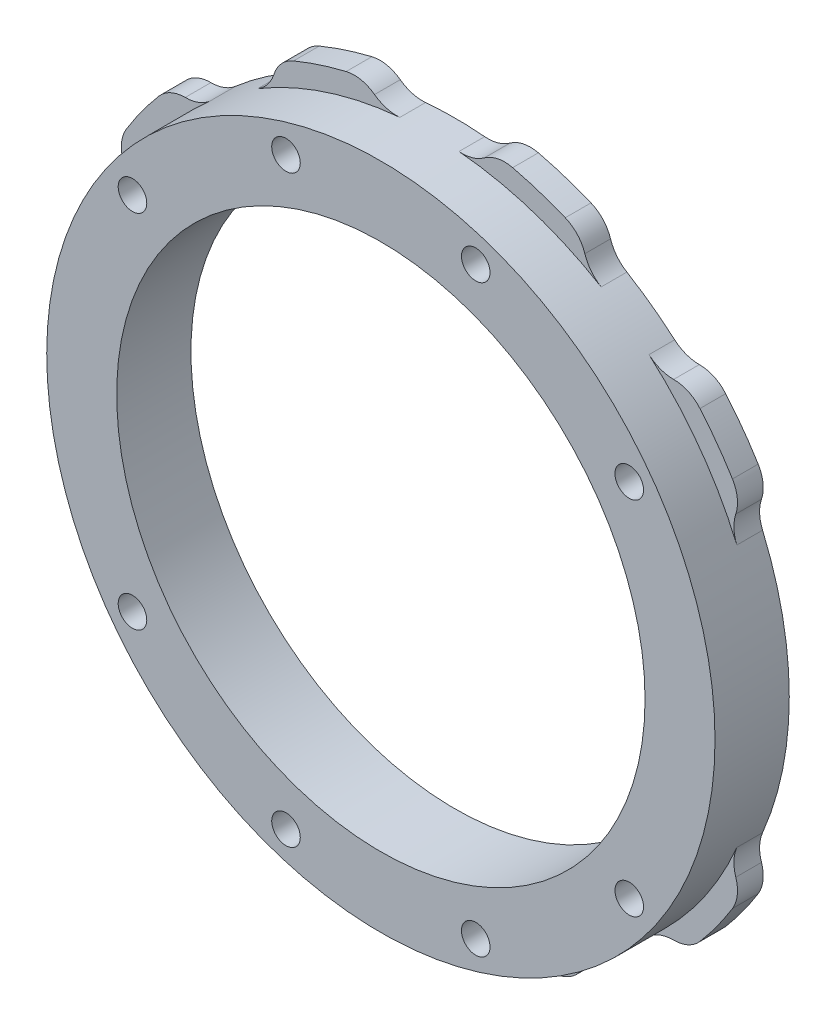
from build123d import *

# Parameters (mm, degrees)
SKIZZE1_R                       = 18.5
LINEAR_AUSTRAGEN1_DEPTH         = 1.8
SKIZZE2_R                       = 23.4
SKIZZE2_R_2                     = 18.5
LINEAR_AUSTRAGEN2_DEPTH         = 3.4
SKIZZE3_R                       = 1
SCHNITT_LINEAR_AUSTRAGEN1_DEPTH = 35.115425177
CHAMFER1_SIZE                   = 1.4


with BuildPart() as part:
    # Skizze1 → Linear austragen1 (new body)
    with BuildSketch(Plane.XY):
        with BuildLine():
            ThreePointArc((-22.806936421, 5.234849671), (-23.4, 0), (-22.806936421, -5.234849671))
            ThreePointArc((-22.806936421, -5.234849671), (-22.254722481, -7.230997668), (-21.528166589, -9.170498531))
            ThreePointArc((-21.528166589, -9.170498531), (-21.322328126, -10.083900652), (-21.453393631, -11.010990043))
            ThreePointArc((-21.453393631, -11.010990043), (-21.560643818, -12.043510102), (-21.221833257, -13.024737741))
            ThreePointArc((-21.221833257, -13.024737741), (-20.14452316, -14.635852782), (-18.94516883, -16.158297497))
            ThreePointArc((-18.94516883, -16.158297497), (-18.116664111, -16.783741505), (-17.10153705, -17.000806761))
            ThreePointArc((-17.10153705, -17.000806761), (-16.179321175, -17.162642436), (-15.37423172, -17.640663225))
            ThreePointArc((-15.37423172, -17.640663225), (-13.754174904, -18.930997668), (-12.026368835, -20.073027989))
            ThreePointArc((-12.026368835, -20.073027989), (-11.322957725, -20.690997014), (-10.884062474, -21.518066457))
            ThreePointArc((-10.884062474, -21.518066457), (-10.363929634, -22.416432811), (-9.513074997, -23.011114795))
            ThreePointArc((-9.513074997, -23.011114795), (-7.69452316, -23.681307256), (-5.829354574, -24.208028116))
            ThreePointArc((-5.829354574, -24.208028116), (-4.791453413, -24.227040092), (-3.842610612, -23.805972857))
            ThreePointArc((-3.842610612, -23.805972857), (-3.001397674, -23.394835778), (-2.069093052, -23.308343012))
            ThreePointArc((-2.069093052, -23.308343012), (0, -23.4), (2.069093052, -23.308343012))
            ThreePointArc((2.069093052, -23.308343012), (3.001397674, -23.394835778), (3.842610612, -23.805972857))
            ThreePointArc((3.842610612, -23.805972857), (4.791453413, -24.227040092), (5.829354574, -24.208028116))
            ThreePointArc((5.829354574, -24.208028116), (7.69452316, -23.681307256), (9.513074997, -23.011114795))
            ThreePointArc((9.513074997, -23.011114795), (10.363929634, -22.416432811), (10.884062474, -21.518066457))
            ThreePointArc((10.884062474, -21.518066457), (11.322957725, -20.690997014), (12.026368835, -20.073027989))
            ThreePointArc((12.026368835, -20.073027989), (13.754174904, -18.930997668), (15.37423172, -17.640663225))
            ThreePointArc((15.37423172, -17.640663225), (16.179321175, -17.162642436), (17.10153705, -17.000806761))
            ThreePointArc((17.10153705, -17.000806761), (18.116664111, -16.783741505), (18.94516883, -16.158297497))
            ThreePointArc((18.94516883, -16.158297497), (20.14452316, -14.635852782), (21.221833257, -13.024737741))
            ThreePointArc((21.221833257, -13.024737741), (21.560643818, -12.043510102), (21.453393631, -11.010990043))
            ThreePointArc((21.453393631, -11.010990043), (21.322328126, -10.083900652), (21.528166589, -9.170498531))
            ThreePointArc((21.528166589, -9.170498531), (22.254722481, -7.230997668), (22.806936421, -5.234849671))
            ThreePointArc((22.806936421, -5.234849671), (23.4, 0), (22.806936421, 5.234849671))
            ThreePointArc((22.806936421, 5.234849671), (22.254722481, 7.230997668), (21.528166589, 9.170498531))
            ThreePointArc((21.528166589, 9.170498531), (21.322328126, 10.083900652), (21.453393631, 11.010990043))
            ThreePointArc((21.453393631, 11.010990043), (21.560643818, 12.043510102), (21.221833257, 13.024737741))
            ThreePointArc((21.221833257, 13.024737741), (20.14452316, 14.635852782), (18.94516883, 16.158297497))
            ThreePointArc((18.94516883, 16.158297497), (18.116664111, 16.783741505), (17.10153705, 17.000806761))
            ThreePointArc((17.10153705, 17.000806761), (16.179321175, 17.162642436), (15.37423172, 17.640663225))
            ThreePointArc((15.37423172, 17.640663225), (13.754174904, 18.930997668), (12.026368835, 20.073027989))
            ThreePointArc((12.026368835, 20.073027989), (11.322957725, 20.690997014), (10.884062474, 21.518066457))
            ThreePointArc((10.884062474, 21.518066457), (10.363929634, 22.416432811), (9.513074997, 23.011114795))
            ThreePointArc((9.513074997, 23.011114795), (7.69452316, 23.681307256), (5.829354574, 24.208028116))
            ThreePointArc((5.829354574, 24.208028116), (4.791453413, 24.227040092), (3.842610612, 23.805972857))
            ThreePointArc((3.842610612, 23.805972857), (3.001397674, 23.394835778), (2.069093052, 23.308343012))
            ThreePointArc((2.069093052, 23.308343012), (0, 23.4), (-2.069093052, 23.308343012))
            ThreePointArc((-2.069093052, 23.308343012), (-3.001397674, 23.394835778), (-3.842610612, 23.805972857))
            ThreePointArc((-3.842610612, 23.805972857), (-4.791453413, 24.227040092), (-5.829354574, 24.208028116))
            ThreePointArc((-5.829354574, 24.208028116), (-7.69452316, 23.681307256), (-9.513074997, 23.011114795))
            ThreePointArc((-9.513074997, 23.011114795), (-10.363929634, 22.416432811), (-10.884062474, 21.518066457))
            ThreePointArc((-10.884062474, 21.518066457), (-11.322957725, 20.690997014), (-12.026368835, 20.073027989))
            ThreePointArc((-12.026368835, 20.073027989), (-13.754174904, 18.930997668), (-15.37423172, 17.640663225))
            ThreePointArc((-15.37423172, 17.640663225), (-16.179321175, 17.162642436), (-17.10153705, 17.000806761))
            ThreePointArc((-17.10153705, 17.000806761), (-18.116664111, 16.783741505), (-18.94516883, 16.158297497))
            ThreePointArc((-18.94516883, 16.158297497), (-20.14452316, 14.635852782), (-21.221833257, 13.024737741))
            ThreePointArc((-21.221833257, 13.024737741), (-21.560643818, 12.043510102), (-21.453393631, 11.010990043))
            ThreePointArc((-21.453393631, 11.010990043), (-21.322328126, 10.083900652), (-21.528166589, 9.170498531))
            ThreePointArc((-21.528166589, 9.170498531), (-22.254722481, 7.230997668), (-22.806936421, 5.234849671))
        make_face()
        Circle(SKIZZE1_R, mode=Mode.SUBTRACT)
    extrude(amount=LINEAR_AUSTRAGEN1_DEPTH)

    # Skizze2 → Linear austragen2 (add)
    with BuildSketch(Plane.XY.offset(1.8)):
        with Locations(Location((0, 0, 0), (0, 0, 156.927122734))):
            Circle(SKIZZE2_R)
        Circle(SKIZZE2_R_2, mode=Mode.SUBTRACT)
    extrude(amount=LINEAR_AUSTRAGEN2_DEPTH)

    # Skizze3 → Schnitt-Linear austragen1 (cut, through all)
    with BuildSketch(Plane.XY.offset(5.2)):
        with Locations((-6.643865379, 20.4477151)):
            Circle(SKIZZE3_R)
        with Locations((6.643865379, 20.4477151)):
            Circle(SKIZZE3_R)
        with Locations((17.393865379, 12.637382924)):
            Circle(SKIZZE3_R)
        with Locations((17.393865379, -12.637382924)):
            Circle(SKIZZE3_R)
        with Locations((6.643865379, -20.4477151)):
            Circle(SKIZZE3_R)
        with Locations((-6.643865379, -20.4477151)):
            Circle(SKIZZE3_R)
        with Locations((-17.393865379, -12.637382924)):
            Circle(SKIZZE3_R)
        with Locations((-17.393865379, 12.637382924)):
            Circle(SKIZZE3_R)
    extrude(amount=-SCHNITT_LINEAR_AUSTRAGEN1_DEPTH, mode=Mode.SUBTRACT)

    # Chamfer1
    chamfer1_edges = [part.edges().sort_by_distance(p)[0] for p in [
        (-7.643865379, 20.4477151, 0),
        (5.643865379, 20.4477151, 0),
        (16.393865379, 12.637382924, 0),
        (16.393865379, -12.637382924, 0),
        (5.643865379, -20.4477151, 0),
        (-7.643865379, -20.4477151, 0),
        (-18.393865379, -12.637382924, 0),
        (-18.393865379, 12.637382924, 0),
    ]]
    chamfer(chamfer1_edges, length=CHAMFER1_SIZE)


solid = part.part
